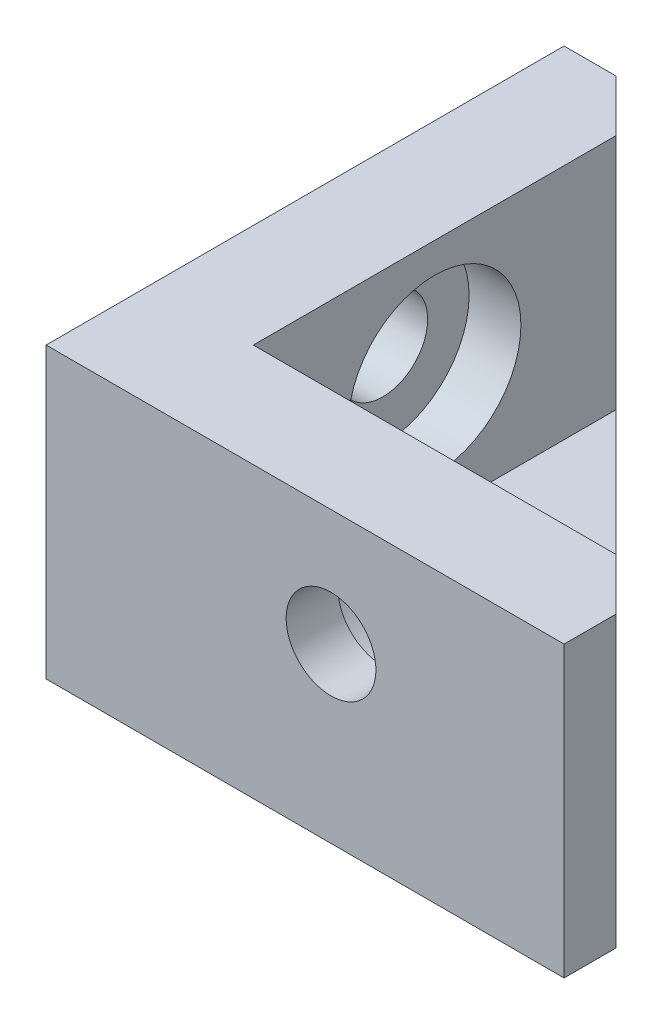
from build123d import *

# Parameters (mm, degrees)
EXTRUDE_1_DEPTH     = 20
EXTRUDE_2_DEPTH     = 2
CUT_EXTRUDE_2_DEPTH = 30
CUT_EXTRUDE_3_DEPTH = 30
SKETCH_8_W          = 27
SKETCH_8_H          = 18
SKETCH_8_R          = 5
EXTRUDE_3_DEPTH     = 3
SKETCH_9_W          = 24
SKETCH_9_H          = 18
SKETCH_9_R          = 5
EXTRUDE_4_DEPTH     = 3
CUT_EXTRUDE_4_DEPTH = 30
SKETCH_12_W         = 30
SKETCH_12_H         = 3.25
CUT_EXTRUDE_5_DEPTH = 30
EXTRUDE_5_DEPTH     = 3


with BuildPart() as part:
    # 草图1 → 凸台-拉伸1 (new body)
    with BuildSketch(Plane(origin=(0, 0, 0), x_dir=(1, 0, 0), z_dir=(0, 1, 0))):
        Polygon((0, 0), (0, 30), (3, 30), (3, 3), (30, 3), (30, 0), align=None)
    extrude(amount=EXTRUDE_1_DEPTH)

    # 草图2 → 凸台-拉伸2 (add)
    with BuildSketch(Plane.XZ):
        Polygon((3, -30), (30, -3), (3, -3), align=None)
    extrude(amount=-EXTRUDE_2_DEPTH)

    # 草图5 → 切除-拉伸2 (cut)
    with BuildSketch(Plane(origin=(0, 0, -3), x_dir=(-1, 0, 0), z_dir=(0, 0, -1))):
        with BuildLine():
            ThreePointArc((-13.9, 10), (-15.685152354, 12.469012619), (-18.589248703, 11.547591632))
            Line((-18.589248703, 11.547591632), (-14.410751297, 8.452408368))
            ThreePointArc((-14.410751297, 8.452408368), (-14.030987381, 9.185152354), (-13.9, 10))
        make_face()
        with BuildLine():
            Line((-14.410751297, 8.452408368), (-18.589248703, 11.547591632))
            ThreePointArc((-18.589248703, 11.547591632), (-18.047591632, 7.910751297), (-14.410751297, 8.452408368))
        make_face()
    extrude(amount=-CUT_EXTRUDE_2_DEPTH, mode=Mode.SUBTRACT)

    # 草图7 → 切除-拉伸3 (cut)
    with BuildSketch(Plane(origin=(3, 0, 0), x_dir=(0, 0, -1), z_dir=(1, 0, 0))):
        with BuildLine():
            ThreePointArc((19.1, 10), (17.314847646, 12.469012619), (14.410751297, 11.547591632))
            Line((14.410751297, 11.547591632), (18.589248703, 8.452408368))
            ThreePointArc((18.589248703, 8.452408368), (18.969012619, 9.185152354), (19.1, 10))
        make_face()
        with BuildLine():
            Line((18.589248703, 8.452408368), (14.410751297, 11.547591632))
            ThreePointArc((14.410751297, 11.547591632), (14.952408368, 7.910751297), (18.589248703, 8.452408368))
        make_face()
    extrude(amount=-CUT_EXTRUDE_3_DEPTH, mode=Mode.SUBTRACT)

    # 草图8 → 凸台-拉伸3 (add)
    with BuildSketch(Plane(origin=(0, 0, -3), x_dir=(-1, 0, 0), z_dir=(0, 0, -1))):
        with Locations((-16.5, 11)):
            Rectangle(SKETCH_8_W, SKETCH_8_H)
        with Locations((-16.5, 10)):
            Circle(SKETCH_8_R, mode=Mode.SUBTRACT)
    extrude(amount=EXTRUDE_3_DEPTH)

    # 草图9 → 凸台-拉伸4 (add)
    with BuildSketch(Plane(origin=(3, 0, 0), x_dir=(0, 0, -1), z_dir=(1, 0, 0))):
        with Locations((18, 11)):
            Rectangle(SKETCH_9_W, SKETCH_9_H)
        with Locations((16.5, 10)):
            Circle(SKETCH_9_R, mode=Mode.SUBTRACT)
    extrude(amount=EXTRUDE_4_DEPTH)

    # 草图10 → 切除-拉伸4 (cut)
    with BuildSketch(Plane.XZ.offset(-2)):
        Polygon((3, -30), (6, -27), (6, -30), align=None)
        Polygon((27, -6), (30, -3), (30, -6), align=None)
    extrude(amount=-CUT_EXTRUDE_4_DEPTH, mode=Mode.SUBTRACT)

    # 草图12 → 切除-拉伸5 (cut)
    with BuildSketch(Plane(origin=(30, 0, 0), x_dir=(0, 0, -1), z_dir=(1, 0, 0))):
        with Locations((15, 18.375)):
            Rectangle(SKETCH_12_W, SKETCH_12_H)
    extrude(amount=-CUT_EXTRUDE_5_DEPTH, mode=Mode.SUBTRACT)

    # 草图13 → 凸台-拉伸5 (add)
    with BuildSketch(Plane.XZ):
        Polygon((3, -30), (3, -3), (30, -3), align=None)
    extrude(amount=-EXTRUDE_5_DEPTH)


solid = part.part
